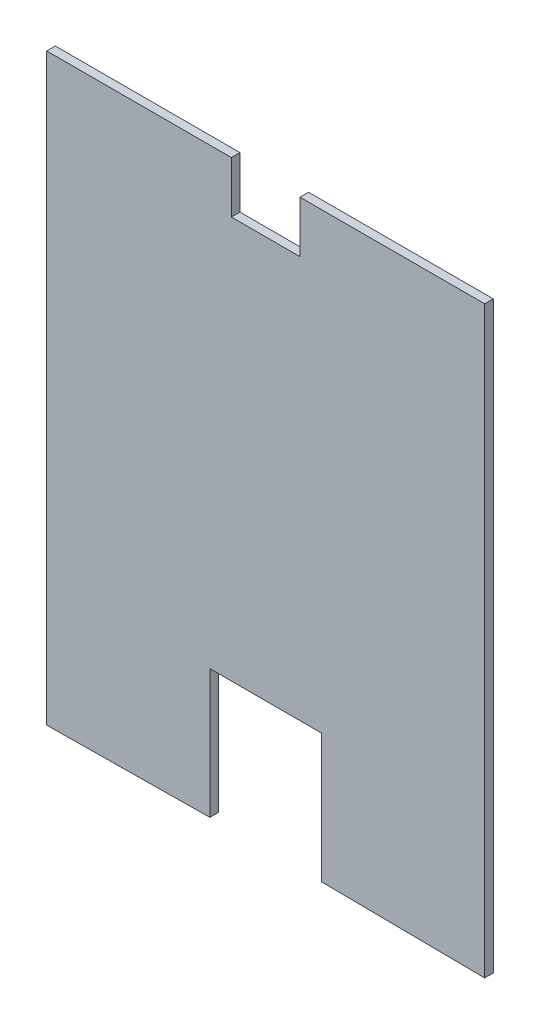
from build123d import *

# Parameters (mm, degrees)
BOSS_EXTRUDE1_DEPTH = 5


with BuildPart() as part:
    # Sketch1 → Boss-Extrude1 (new body)
    with BuildSketch(Plane.XY):
        Polygon((-485.570077519, -254.386109851), (-390.570077519, -253.386109851), (-390.570077519, -178.386109851), (-325.570077519, -178.386109851), (-325.570077519, -253.386109851), (-230.570077519, -254.386109851), (-230.570077519, 85.613890149), (-338.070077519, 85.613890149), (-338.070077519, 55.613890149), (-378.070077519, 55.613890149), (-378.070077519, 85.613890149), (-485.570077519, 85.613890149), align=None)
    extrude(amount=BOSS_EXTRUDE1_DEPTH)


solid = part.part
